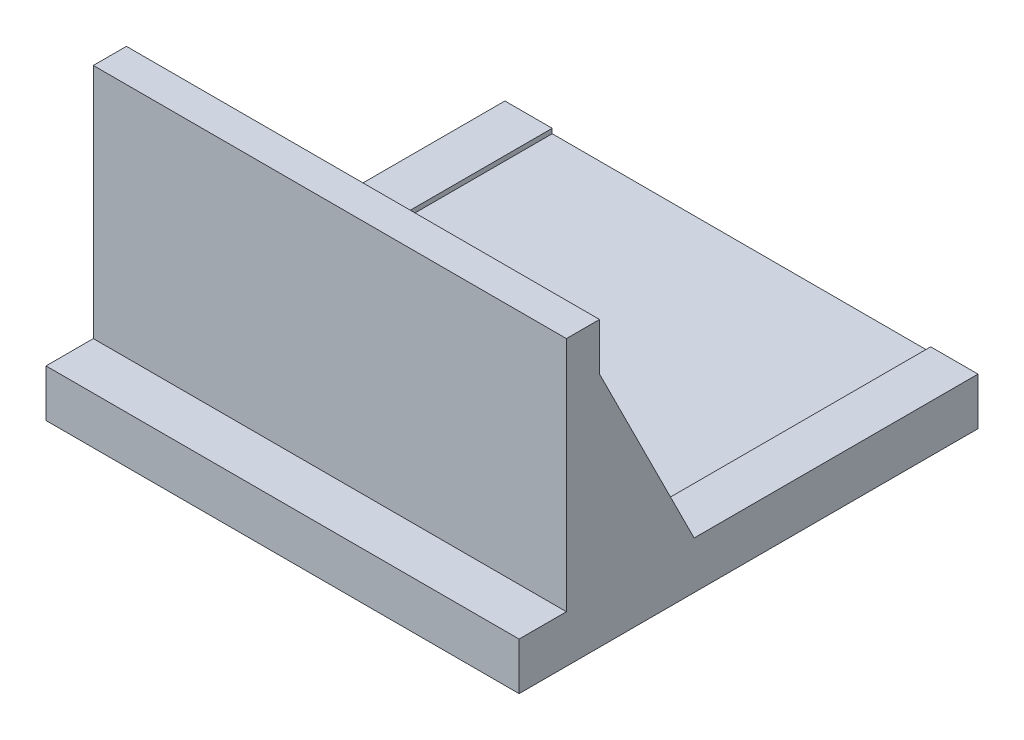
from build123d import *

# Parameters (mm, degrees)
SKETCH_1_W          = 100
SKETCH_1_H          = 60
EXTRUDE_1_DEPTH     = 37
SKETCH_2_W          = 10
SKETCH_2_H          = 50
CUT_EXTRUDE_1_DEPTH = 111.7655181
SKETCH_3_W          = 80
SKETCH_3_H          = 20
CUT_EXTRUDE_2_DEPTH = 50
CUT_EXTRUDE_3_DEPTH = 111.7655181
SKETCH_5_W          = 80
SKETCH_5_H          = 20
CUT_EXTRUDE_4_DEPTH = 1
EXTRUDE_2_DEPTH     = 60


with BuildPart() as part:
    # 草图1 → 凸台-拉伸1 (new body)
    with BuildSketch(Plane.XY):
        Rectangle(SKETCH_1_W, SKETCH_1_H)
    extrude(amount=EXTRUDE_1_DEPTH)

    # 草图2 → 切除-拉伸1 (cut, through all)
    with BuildSketch(Plane(origin=(50, 0, 0), x_dir=(0, 0, -1), z_dir=(1, 0, 0))):
        with Locations((-32, 5)):
            Rectangle(SKETCH_2_W, SKETCH_2_H)
    extrude(amount=-CUT_EXTRUDE_1_DEPTH, mode=Mode.SUBTRACT)

    # 草图3 → 切除-拉伸2 (cut)
    with BuildSketch(Plane(origin=(0, 30, 0), x_dir=(1, 0, 0), z_dir=(0, 1, 0))):
        with Locations((0, -10)):
            Rectangle(SKETCH_3_W, SKETCH_3_H)
    extrude(amount=-CUT_EXTRUDE_2_DEPTH, mode=Mode.SUBTRACT)

    # 草图4 → 切除-拉伸3 (cut, through all)
    with BuildSketch(Plane(origin=(50, 0, 0), x_dir=(0, 0, -1), z_dir=(1, 0, 0))):
        Polygon((0, 30), (-20, 30), (-20, 20), (0, -20), align=None)
    extrude(amount=-CUT_EXTRUDE_3_DEPTH, mode=Mode.SUBTRACT)

    # 草图5 → 切除-拉伸4 (cut)
    with BuildSketch(Plane(origin=(0, -20, 0), x_dir=(1, 0, 0), z_dir=(0, 1, 0))):
        with Locations((0, -10)):
            Rectangle(SKETCH_5_W, SKETCH_5_H)
    extrude(amount=-CUT_EXTRUDE_4_DEPTH, mode=Mode.SUBTRACT)

    # 草图7 → 凸台-拉伸2 (add)
    with BuildSketch(Plane(origin=(0, 0, 0), x_dir=(-1, 0, 0), z_dir=(0, 0, -1))):
        Polygon((50, -20), (40, -20), (40, -21), (-40, -21), (-40, -20), (-50, -20), (-50, -30), (50, -30), align=None)
    extrude(amount=EXTRUDE_2_DEPTH)


solid = part.part
